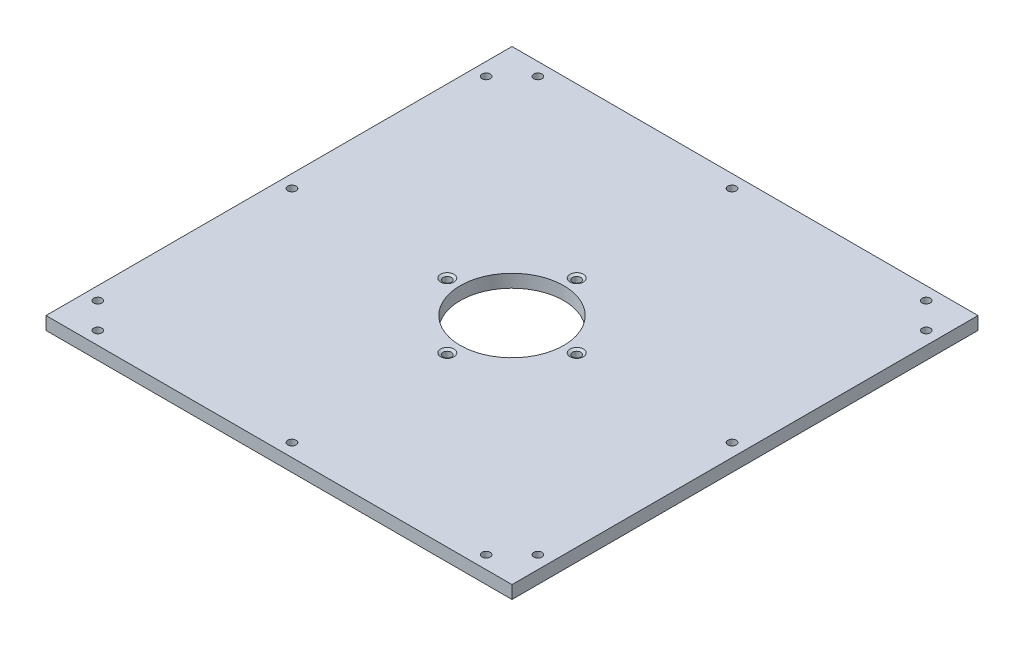
from build123d import *
from OCP.BRepFilletAPI import BRepFilletAPI_MakeChamfer

# Parameters (mm, degrees)
SKETCH1_W           = 180
SKETCH1_H           = 180
SKETCH1_R           = 20
SKETCH1_R_2         = 1.6
BOSS_EXTRUDE1_DEPTH = 5
CHAMFER3_SIZE       = 1
CHAMFER3_SIZE2      = 0.577350269
CHAMFER4_SIZE       = 1
CHAMFER4_SIZE2      = 0.577350269


with BuildPart() as part:
    # Sketch1 → Boss-Extrude1 (new body)
    with BuildSketch(Plane(origin=(0, 0, 0), x_dir=(1, 0, 0), z_dir=(0, 1, 0))):
        with Locations((90, 90)):
            Rectangle(SKETCH1_W, SKETCH1_H)
        with Locations(Location((90, 90, 0), (0, 0, 270))):
            Circle(SKETCH1_R, mode=Mode.SUBTRACT)
        with Locations(Location((5, 165, 0), (0, 0, 270))):
            Circle(SKETCH1_R_2, mode=Mode.SUBTRACT)
        with Locations(Location((5, 90, 0), (0, 0, 270))):
            Circle(SKETCH1_R_2, mode=Mode.SUBTRACT)
        with Locations(Location((5, 15, 0), (0, 0, 90))):
            Circle(SKETCH1_R_2, mode=Mode.SUBTRACT)
        with Locations(Location((175, 15, 0), (0, 0, 270))):
            Circle(SKETCH1_R_2, mode=Mode.SUBTRACT)
        with Locations(Location((175, 90, 0), (0, 0, 90))):
            Circle(SKETCH1_R_2, mode=Mode.SUBTRACT)
        with Locations(Location((175, 165, 0), (0, 0, 90))):
            Circle(SKETCH1_R_2, mode=Mode.SUBTRACT)
        with Locations(Location((15, 175, 0), (0, 0, 270))):
            Circle(SKETCH1_R_2, mode=Mode.SUBTRACT)
        with Locations(Location((90, 175, 0), (0, 0, 270))):
            Circle(SKETCH1_R_2, mode=Mode.SUBTRACT)
        with Locations(Location((165, 175, 0), (0, 0, 90))):
            Circle(SKETCH1_R_2, mode=Mode.SUBTRACT)
        with Locations(Location((165, 5, 0), (0, 0, 270))):
            Circle(SKETCH1_R_2, mode=Mode.SUBTRACT)
        with Locations(Location((90, 5, 0), (0, 0, 90))):
            Circle(SKETCH1_R_2, mode=Mode.SUBTRACT)
        with Locations(Location((15, 5, 0), (0, 0, 90))):
            Circle(SKETCH1_R_2, mode=Mode.SUBTRACT)
        with Locations(Location((90, 115, 0), (0, 0, 270))):
            Circle(SKETCH1_R_2, mode=Mode.SUBTRACT)
        with Locations(Location((90, 65, 0), (0, 0, 90))):
            Circle(SKETCH1_R_2, mode=Mode.SUBTRACT)
        with Locations(Location((65, 90, 0), (0, 0, 270))):
            Circle(SKETCH1_R_2, mode=Mode.SUBTRACT)
        with Locations(Location((115, 90, 0), (0, 0, 90))):
            Circle(SKETCH1_R_2, mode=Mode.SUBTRACT)
    extrude(amount=BOSS_EXTRUDE1_DEPTH)

    # Chamfer3
    chamfer3_edges = [part.edges().sort_by_distance(p)[0] for p in [
        (90, 5, -116.6),
        (90, 5, -63.4),
        (65, 5, -91.6),
        (115, 5, -88.4),
    ]]
    chamfer3_side = [part.faces().sort_by_distance(p)[0] for p in [
        (90, 5, -2.545584412),
    ]]
    chamfer(chamfer3_edges, length=CHAMFER3_SIZE, length2=CHAMFER3_SIZE2, reference=chamfer3_side[0])

    # Chamfer4: one chamfer whose edges measure the first distance from different faces: ONE call of the kernel's chamfer builder (chamfer() names one face for all edges)
    chamfer4_edges_1 = [part.edges().sort_by_distance(p)[0] for p in [
        (175, 0, -16.6),
    ]]
    chamfer4_side_1 = [part.faces().sort_by_distance(p)[0] for p in [
        (175, 2.5, -16.6),
    ]]
    chamfer4_edges_2 = [part.edges().sort_by_distance(p)[0] for p in [
        (5, 0, -166.6),
    ]]
    chamfer4_side_2 = [part.faces().sort_by_distance(p)[0] for p in [
        (5, 2.5, -166.6),
    ]]
    chamfer4_edges_3 = [part.edges().sort_by_distance(p)[0] for p in [
        (5, 0, -91.6),
    ]]
    chamfer4_side_3 = [part.faces().sort_by_distance(p)[0] for p in [
        (5, 2.5, -91.6),
    ]]
    chamfer4_edges_4 = [part.edges().sort_by_distance(p)[0] for p in [
        (15, 0, -176.6),
    ]]
    chamfer4_side_4 = [part.faces().sort_by_distance(p)[0] for p in [
        (15, 2.5, -176.6),
    ]]
    chamfer4_edges_5 = [part.edges().sort_by_distance(p)[0] for p in [
        (5, 0, -13.4),
    ]]
    chamfer4_side_5 = [part.faces().sort_by_distance(p)[0] for p in [
        (5, 2.5, -13.4),
    ]]
    chamfer4_edges_6 = [part.edges().sort_by_distance(p)[0] for p in [
        (175, 0, -88.4),
    ]]
    chamfer4_side_6 = [part.faces().sort_by_distance(p)[0] for p in [
        (175, 2.5, -88.4),
    ]]
    chamfer4_edges_7 = [part.edges().sort_by_distance(p)[0] for p in [
        (175, 0, -163.4),
    ]]
    chamfer4_side_7 = [part.faces().sort_by_distance(p)[0] for p in [
        (175, 2.5, -163.4),
    ]]
    chamfer4_edges_8 = [part.edges().sort_by_distance(p)[0] for p in [
        (90, 0, -176.6),
    ]]
    chamfer4_side_8 = [part.faces().sort_by_distance(p)[0] for p in [
        (90, 2.5, -176.6),
    ]]
    chamfer4_edges_9 = [part.edges().sort_by_distance(p)[0] for p in [
        (165, 0, -173.4),
    ]]
    chamfer4_side_9 = [part.faces().sort_by_distance(p)[0] for p in [
        (165, 2.5, -173.4),
    ]]
    chamfer4_edges_10 = [part.edges().sort_by_distance(p)[0] for p in [
        (165, 0, -6.6),
    ]]
    chamfer4_side_10 = [part.faces().sort_by_distance(p)[0] for p in [
        (165, 2.5, -6.6),
    ]]
    chamfer4_edges_11 = [part.edges().sort_by_distance(p)[0] for p in [
        (90, 0, -3.4),
    ]]
    chamfer4_side_11 = [part.faces().sort_by_distance(p)[0] for p in [
        (90, 2.5, -3.4),
    ]]
    chamfer4_edges_12 = [part.edges().sort_by_distance(p)[0] for p in [
        (15, 0, -3.4),
    ]]
    chamfer4_side_12 = [part.faces().sort_by_distance(p)[0] for p in [
        (15, 2.5, -3.4),
    ]]
    chamfer4 = BRepFilletAPI_MakeChamfer(part.part.solid().wrapped)
    for e in chamfer4_edges_1:
        chamfer4.Add(CHAMFER4_SIZE, CHAMFER4_SIZE2, e.wrapped, chamfer4_side_1[0].wrapped)  # the first distance lies on this face
    for e in chamfer4_edges_2:
        chamfer4.Add(CHAMFER4_SIZE, CHAMFER4_SIZE2, e.wrapped, chamfer4_side_2[0].wrapped)  # the first distance lies on this face
    for e in chamfer4_edges_3:
        chamfer4.Add(CHAMFER4_SIZE, CHAMFER4_SIZE2, e.wrapped, chamfer4_side_3[0].wrapped)  # the first distance lies on this face
    for e in chamfer4_edges_4:
        chamfer4.Add(CHAMFER4_SIZE, CHAMFER4_SIZE2, e.wrapped, chamfer4_side_4[0].wrapped)  # the first distance lies on this face
    for e in chamfer4_edges_5:
        chamfer4.Add(CHAMFER4_SIZE, CHAMFER4_SIZE2, e.wrapped, chamfer4_side_5[0].wrapped)  # the first distance lies on this face
    for e in chamfer4_edges_6:
        chamfer4.Add(CHAMFER4_SIZE, CHAMFER4_SIZE2, e.wrapped, chamfer4_side_6[0].wrapped)  # the first distance lies on this face
    for e in chamfer4_edges_7:
        chamfer4.Add(CHAMFER4_SIZE, CHAMFER4_SIZE2, e.wrapped, chamfer4_side_7[0].wrapped)  # the first distance lies on this face
    for e in chamfer4_edges_8:
        chamfer4.Add(CHAMFER4_SIZE, CHAMFER4_SIZE2, e.wrapped, chamfer4_side_8[0].wrapped)  # the first distance lies on this face
    for e in chamfer4_edges_9:
        chamfer4.Add(CHAMFER4_SIZE, CHAMFER4_SIZE2, e.wrapped, chamfer4_side_9[0].wrapped)  # the first distance lies on this face
    for e in chamfer4_edges_10:
        chamfer4.Add(CHAMFER4_SIZE, CHAMFER4_SIZE2, e.wrapped, chamfer4_side_10[0].wrapped)  # the first distance lies on this face
    for e in chamfer4_edges_11:
        chamfer4.Add(CHAMFER4_SIZE, CHAMFER4_SIZE2, e.wrapped, chamfer4_side_11[0].wrapped)  # the first distance lies on this face
    for e in chamfer4_edges_12:
        chamfer4.Add(CHAMFER4_SIZE, CHAMFER4_SIZE2, e.wrapped, chamfer4_side_12[0].wrapped)  # the first distance lies on this face
    add(Compound.cast(chamfer4.Shape()), mode=Mode.REPLACE)


solid = part.part
